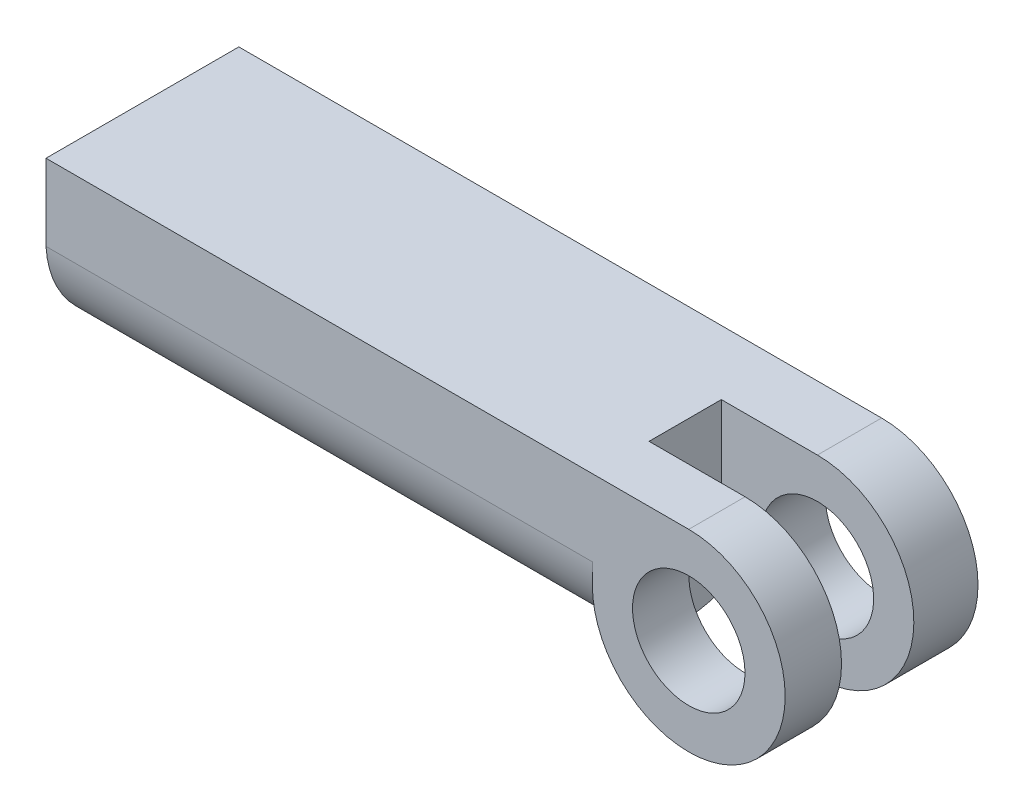
from build123d import *

# Parameters (mm, degrees)
SKETCH1_R           = 7.00000696
BOSS_EXTRUDE1_DEPTH = 24
SKETCH2_W           = 9
SKETCH2_H           = 24
CUT_EXTRUDE1_DEPTH  = 32
SKETCH3_OUTSIDE_W   = 45.612
SKETCH3_OUTSIDE_H   = 45.612
CUT_EXTRUDE3_DEPTH  = 68
SKETCH4_R           = 9
CUT_EXTRUDE4_DEPTH  = 67


with BuildPart() as part:
    # Sketch1 → Boss-Extrude1 (new body)
    with BuildSketch(Plane.XY):
        with BuildLine():
            Line((-50.044390832, 27.503498209), (29.955609168, 27.503498209))
            ThreePointArc((29.955609168, 27.503498209), (38.440890542, 7.018216834), (17.955609168, 15.503498209))
            Line((17.955609168, 15.503498209), (17.955609168, 6.136182916))
            Line((17.955609168, 6.136182916), (-39.544390832, 6.003498209))
            Line((-39.544390832, 6.003498209), (-39.544390832, 5.015222645))
            Line((-39.544390832, 5.015222645), (-48.572054411, 5.015222645))
            Line((-48.572054411, 5.015222645), (-48.572054411, 6.003498173))
            Line((-48.572054411, 6.003498173), (-50.044390832, 6.003498173))
            Line((-50.044390832, 6.003498173), (-50.044390832, 27.503498209))
        make_face()
        with Locations((29.955609168, 15.503498209)):
            Circle(SKETCH1_R, mode=Mode.SUBTRACT)
    extrude(amount=BOSS_EXTRUDE1_DEPTH)

    # Sketch2 → Cut-Extrude1 (cut)
    with BuildSketch(Plane(origin=(50, 0, 0), x_dir=(0, 0, -1), z_dir=(1, 0, 0))):
        with Locations((-12.486255169, 15.503498209)):
            Rectangle(SKETCH2_W, SKETCH2_H)
    extrude(amount=-CUT_EXTRUDE1_DEPTH, mode=Mode.SUBTRACT)

    # Sketch3 outside → Cut-Extrude3 (cut)
    with BuildSketch(Plane.ZY.offset(50.044390832)):
        with Locations((12, 15.503)):
            Rectangle(SKETCH3_OUTSIDE_W, SKETCH3_OUTSIDE_H)
        with BuildLine():
            Line((0, 27.503498209), (24, 27.503498209))
            Line((24, 27.503498209), (24, 19.503498209))
            ThreePointArc((24, 19.503498209), (20.795941553, 10.268216816), (12, 6.003498173))
            ThreePointArc((12, 6.003498173), (3.204058447, 10.268216816), (0, 19.503498209))
            Line((0, 19.503498209), (0, 27.503498209))
        make_face(mode=Mode.SUBTRACT)
    extrude(amount=-CUT_EXTRUDE3_DEPTH, mode=Mode.SUBTRACT)

    # Sketch4 → Cut-Extrude4 (cut)
    with BuildSketch(Plane.ZY.offset(50.044390832)):
        with Locations((12, 17.218107651)):
            Circle(SKETCH4_R)
    extrude(amount=-CUT_EXTRUDE4_DEPTH, mode=Mode.SUBTRACT)


solid = part.part
